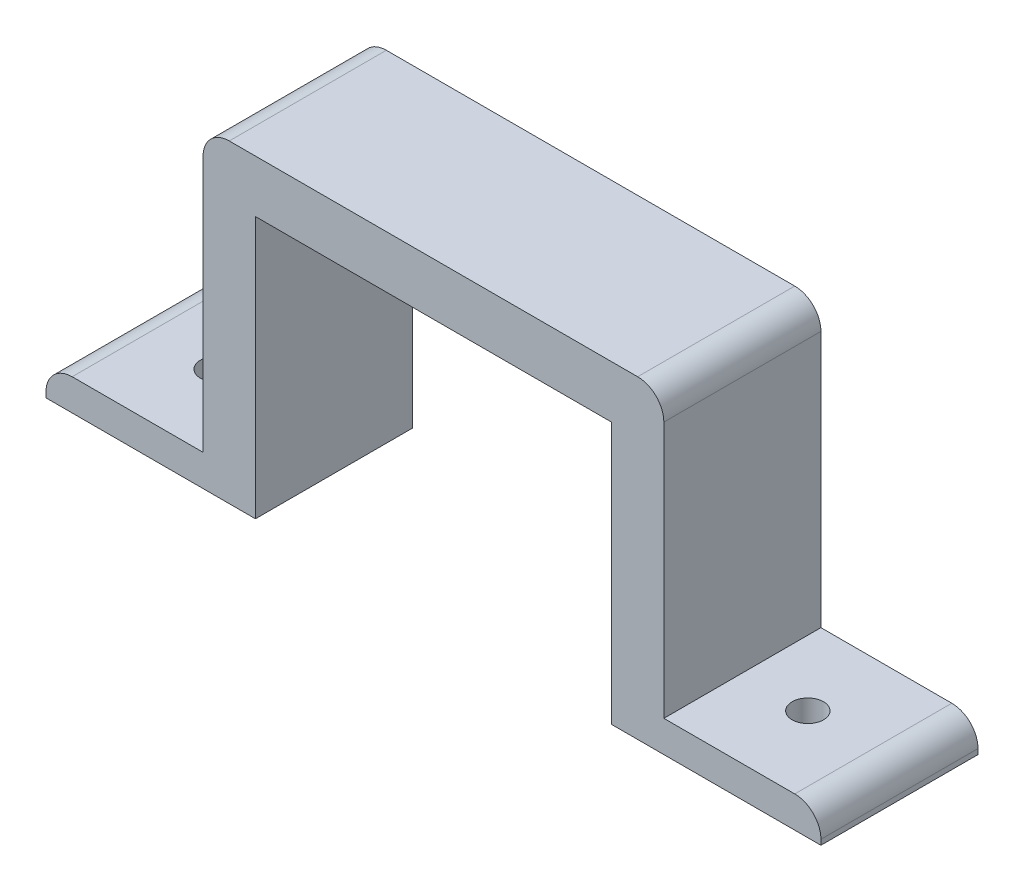
from build123d import *

# Parameters (mm, degrees)
BOSS_EXTRUDE1_DEPTH = 15
FILLET1_R           = 2.5
SKETCH2_R           = 1.5
CUT_EXTRUDE1_DEPTH  = 3


with BuildPart() as part:
    # Sketch1 → Boss-Extrude1 (new body)
    with BuildSketch(Plane.XY):
        Polygon((17, 25), (-17, 25), (-17, 0), (-37, 0), (-37, 3), (-22, 3), (-22, 30), (22, 30), (22, 3), (37, 3), (37, 0), (17, 0), align=None)
    extrude(amount=BOSS_EXTRUDE1_DEPTH)

    # Fillet1
    fillet1_edges = [part.edges().sort_by_distance(p)[0] for p in [
        (-37, 3, 7.5),
        (-22, 30, 7.5),
        (22, 30, 7.5),
        (37, 3, 7.5),
    ]]
    fillet(fillet1_edges, radius=FILLET1_R)

    # Sketch2 → Cut-Extrude1 (cut)
    with BuildSketch(Plane(origin=(0, 3, 0), x_dir=(1, 0, 0), z_dir=(0, 1, 0))):
        with Locations(Location((-28.25, -7.5, 0), (0, 0, 270))):
            Circle(SKETCH2_R)
        with Locations(Location((28.25, -7.5, 0), (0, 0, 270))):
            Circle(SKETCH2_R)
    extrude(amount=-CUT_EXTRUDE1_DEPTH, mode=Mode.SUBTRACT)


solid = part.part
